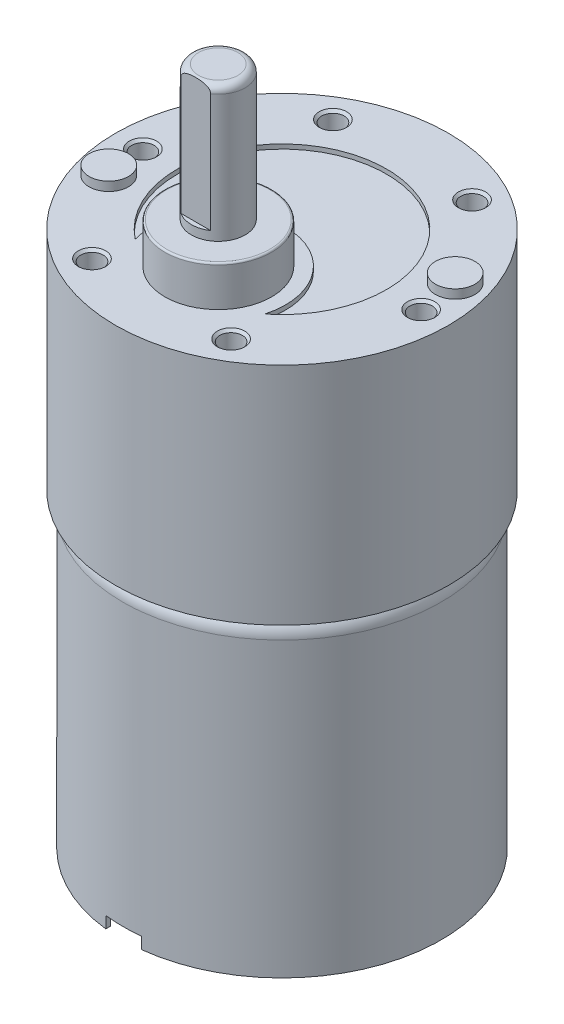
from build123d import *

# Parameters (mm, degrees)
SKETCH1_R           = 17.75
BOSS_EXTRUDE1_DEPTH = 33.3
FILLET1_R           = 2
SKETCH2_R           = 18.55
BOSS_EXTRUDE2_DEPTH = 25.1
SKETCH3_R           = 5.95
BOSS_EXTRUDE3_DEPTH = 4.5
FILLET2_R           = 0.2
SKETCH4_R           = 3
BOSS_EXTRUDE4_DEPTH = 15
FILLET3_R           = 0.8
CUT_EXTRUDE1_START  = -14
CUT_EXTRUDE1_DEPTH  = 14
CUT_EXTRUDE2_DEPTH  = 0.5
CIRPATTERN1_COUNT   = 6
SKETCH11_R          = 2.2
BOSS_EXTRUDE5_DEPTH = 1
CIRPATTERN2_COUNT   = 2
BOSS_EXTRUDE6_START = 1.3
BOSS_EXTRUDE6_DEPTH = 1.3
FILLET4_R           = 0.2
BOSS_EXTRUDE7_DEPTH = 1
BOSS_EXTRUDE8_DEPTH = 0.3
CIRPATTERN3_COUNT   = 2


with BuildPart() as part:
    # Sketch1 → Boss-Extrude1 (new body)
    with BuildSketch(Plane(origin=(0, 0, 0), x_dir=(1, 0, 0), z_dir=(0, 1, 0))):
        with Locations(Location((0, 0, 0), (0, 0, 270))):
            Circle(SKETCH1_R)
    extrude(amount=BOSS_EXTRUDE1_DEPTH)

    # Fillet1
    fillet1_edges = [part.edges().sort_by_distance(p)[0] for p in [
        (0, 33.3, -17.75),
    ]]
    fillet(fillet1_edges, radius=FILLET1_R)

    # Sketch2 → Boss-Extrude2 (add)
    with BuildSketch(Plane(origin=(0, 33.3, 0), x_dir=(1, 0, 0), z_dir=(0, 1, 0))):
        with Locations(Location((0, 0, 0), (0, 0, 270))):
            Circle(SKETCH2_R)
    extrude(amount=BOSS_EXTRUDE2_DEPTH)

    # Sketch3 → Boss-Extrude3 (add)
    with BuildSketch(Plane(origin=(0, 58.4, 0), x_dir=(1, 0, 0), z_dir=(0, 1, 0))):
        with Locations(Location((0, -7.1, 0), (0, 0, 270))):
            Circle(SKETCH3_R)
    extrude(amount=BOSS_EXTRUDE3_DEPTH)

    # Fillet2
    fillet2_edges = [part.edges().sort_by_distance(p)[0] for p in [
        (0, 62.9, 1.15),
    ]]
    fillet(fillet2_edges, radius=FILLET2_R)

    # Sketch4 → Boss-Extrude4 (add)
    with BuildSketch(Plane(origin=(0, 62.9, 0), x_dir=(1, 0, 0), z_dir=(0, 1, 0))):
        with Locations(Location((0, -7.1, 0), (0, 0, 270))):
            Circle(SKETCH4_R)
    extrude(amount=BOSS_EXTRUDE4_DEPTH)

    # Fillet3
    fillet3_edges = [part.edges().sort_by_distance(p)[0] for p in [
        (0, 77.9, 4.1),
    ]]
    fillet(fillet3_edges, radius=FILLET3_R)

    # Sketch6 → Cut-Extrude1 (cut)
    with BuildSketch(Plane(origin=(0, 77.9, 0), x_dir=(1, 0, 0), z_dir=(0, 1, 0)).offset(CUT_EXTRUDE1_START)):
        with BuildLine():
            Line((-1.658312395, -9.6), (1.658312395, -9.6))
            ThreePointArc((1.658312395, -9.6), (0, -10.1), (-1.658312395, -9.6))
        make_face()
    extrude(amount=CUT_EXTRUDE1_DEPTH, mode=Mode.SUBTRACT)

    # Sketch7 → Cut-Extrude2 (cut)
    with BuildSketch(Plane(origin=(0, 58.4, 0), x_dir=(1, 0, 0), z_dir=(0, 1, 0))):
        with BuildLine():
            ThreePointArc((7.215345009, -9.14665493), (0, 0.4), (-7.215345009, -9.14665493))
            ThreePointArc((-7.215345009, -9.14665493), (0, 11.65), (7.215345009, -9.14665493))
        make_face()
    extrude(amount=-CUT_EXTRUDE2_DEPTH, mode=Mode.SUBTRACT)

    # Sketch10 → M3 Tapped Hole1 (revolve, cut)
    with BuildSketch(Plane(origin=(-15.5, 58.4, 0), x_dir=(0, 0, 1), z_dir=(1, 0, 0))):
        Polygon((0, 0), (0, 6.751075774), (1.25, 6), (1.25, 0.275), (1.525, 0), align=None)
    m3_tapped_hole1 = revolve(axis=Axis((-15.5, 64.75, 0), (0, -1, 0)), mode=Mode.SUBTRACT)

    # CirPattern1: M3 Tapped Hole1 ×6 about axis
    cirpattern1_axis = Axis((0, 0, 0), (0, 1, 0))
    for i in range(1, CIRPATTERN1_COUNT):
        add(m3_tapped_hole1.rotate(cirpattern1_axis, i * 360 / CIRPATTERN1_COUNT), mode=Mode.SUBTRACT)

    # Sketch11 → Boss-Extrude5 (add)
    with BuildSketch(Plane(origin=(0, 58.4, 0), x_dir=(1, 0, 0), z_dir=(0, 1, 0))):
        with Locations(Location((-14.846774194, -4.452336021, 0), (0, 0, 270))):
            Circle(SKETCH11_R)
    boss_extrude5 = extrude(amount=BOSS_EXTRUDE5_DEPTH)

    # CirPattern2: Boss-Extrude5 ×2 about axis
    cirpattern2_axis = Axis((0, 0, 0), (0, 1, 0))
    for i in range(1, CIRPATTERN2_COUNT):
        add(boss_extrude5.rotate(cirpattern2_axis, i * 360 / CIRPATTERN2_COUNT))

    # Sketch12 → Boss-Extrude6 (add)
    with BuildSketch(Plane.XZ.offset(BOSS_EXTRUDE6_START)):
        with BuildLine():
            Line((-2, 17.133665691), (-2, 17.636964024))
            ThreePointArc((-2, 17.636964024), (0, -17.75), (2, 17.636964024))
            Line((2, 17.636964024), (2, 17.133665691))
            ThreePointArc((2, 17.133665691), (0, -17.25), (-2, 17.133665691))
        make_face()
    extrude(amount=-BOSS_EXTRUDE6_DEPTH)

    # Sketch14 → Revolve1 (revolve)
    with BuildSketch(Plane.XY, mode=Mode.PRIVATE) as revolve1_sk:
        Polygon((0, -3.8), (0.9, -3.8), (0.9, -3.3), (1.75, -3.3), (1.75, -4.5), (2.55, -4.5), (3.55, -2.9), (4.55, -2.9), (5.05, 0), (0, 0), align=None)
    revolve(revolve1_sk.sketch.rotate(Axis((0, 0, 0), (0, -1, 0)), 180), axis=Axis((0, 0, 0), (0, -1, 0)))

    # Fillet4
    fillet4_edges = [part.edges().sort_by_distance(p)[0] for p in [
        (5.05, 0, 0),
        (4.55, -2.9, 0),
    ]]
    fillet(fillet4_edges, radius=FILLET4_R)

    # Sketch15 → Boss-Extrude7 (add)
    with BuildSketch(Plane.XZ):
        with BuildLine():
            Line((-1.2, 12.75), (1.2, 12.75))
            ThreePointArc((1.2, 12.75), (2.95, 11), (1.2, 9.25))
            Line((1.2, 9.25), (-1.2, 9.25))
            ThreePointArc((-1.2, 9.25), (-2.95, 11), (-1.2, 12.75))
        make_face()
    boss_extrude7 = extrude(amount=BOSS_EXTRUDE7_DEPTH)

    # Sketch16 → Boss-Extrude8 (add, symmetric)
    with BuildSketch(Plane(origin=(0, 0, 11), x_dir=(-1, 0, 0), z_dir=(0, 0, -1))):
        with BuildLine():
            Line((-1.45, -1), (1.45, -1))
            Line((1.45, -1), (1.45, -4.55))
            ThreePointArc((1.45, -4.55), (0, -6), (-1.45, -4.55))
            Line((-1.45, -4.55), (-1.45, -1))
        make_face()
        with BuildLine():
            Line((0.75, -2.75), (0.75, -4.55))
            ThreePointArc((0.75, -4.55), (0, -5.3), (-0.75, -4.55))
            Line((-0.75, -4.55), (-0.75, -2.75))
            ThreePointArc((-0.75, -2.75), (0, -2), (0.75, -2.75))
        make_face(mode=Mode.SUBTRACT)
    boss_extrude8 = extrude(amount=BOSS_EXTRUDE8_DEPTH, both=True)

    # CirPattern3: Boss-Extrude7, Boss-Extrude8 ×2 about axis
    cirpattern3_axis = Axis((0, 0, 0), (0, 1, 0))
    add([boss_extrude7.rotate(cirpattern3_axis, i * 360 / CIRPATTERN3_COUNT) for i in range(1, CIRPATTERN3_COUNT)])
    add([boss_extrude8.rotate(cirpattern3_axis, i * 360 / CIRPATTERN3_COUNT) for i in range(1, CIRPATTERN3_COUNT)])


solid = part.part
